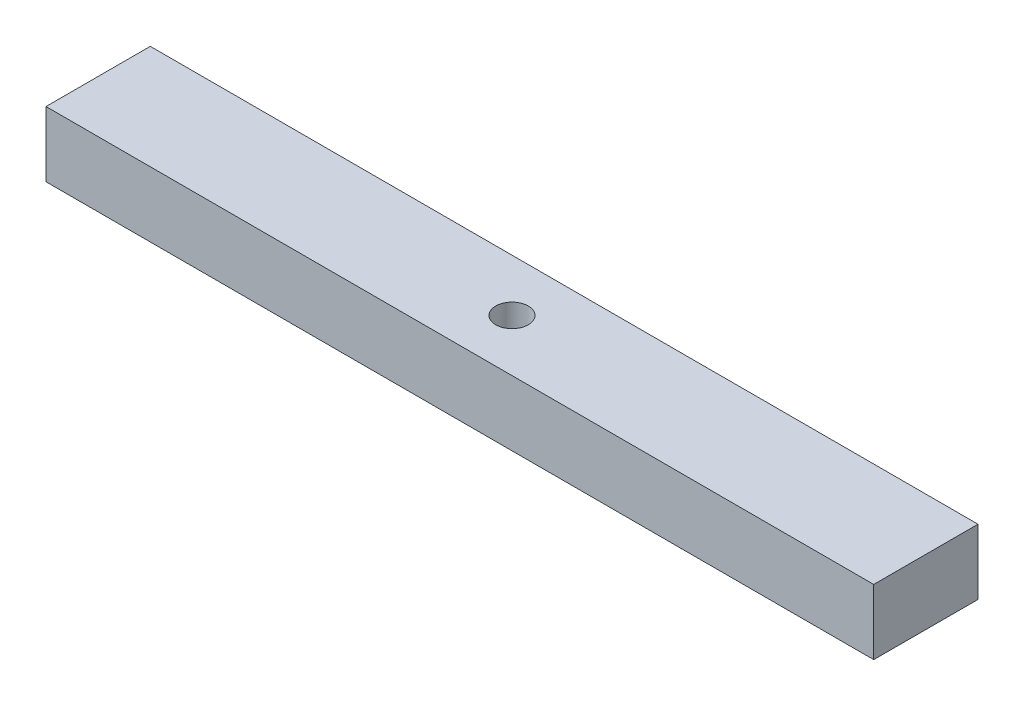
from build123d import *

# Parameters (mm, degrees)
SKETCH1_W           = 127
SKETCH1_H           = 16
SKETCH1_R           = 2.5
BOSS_EXTRUDE1_DEPTH = 10


with BuildPart() as part:
    # Sketch1 → Boss-Extrude1 (new body)
    with BuildSketch(Plane(origin=(0, 0, 0), x_dir=(1, 0, 0), z_dir=(0, 1, 0))):
        Rectangle(SKETCH1_W, SKETCH1_H)
        with Locations(Location((0, 0, 0), (0, 0, 270))):
            Circle(SKETCH1_R, mode=Mode.SUBTRACT)
    extrude(amount=BOSS_EXTRUDE1_DEPTH)


solid = part.part
